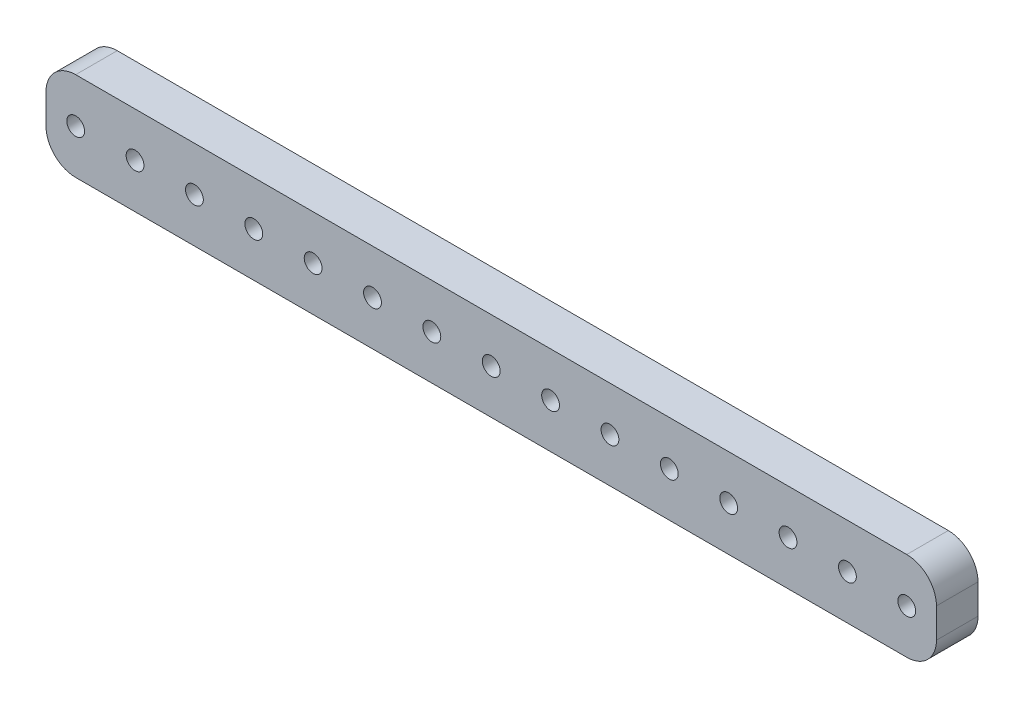
from build123d import *

# Parameters (mm, degrees)
SKETCH1_W           = 300
SKETCH1_H           = 30
BOSS_EXTRUDE1_DEPTH = 14
SKETCH2_R           = 3
CUT_EXTRUDE1_DEPTH  = 14
FILLET1_R           = 10


with BuildPart() as part:
    # Sketch1 → Boss-Extrude1 (new body)
    with BuildSketch(Plane.XY):
        Rectangle(SKETCH1_W, SKETCH1_H)
    extrude(amount=BOSS_EXTRUDE1_DEPTH)

    # Sketch2 → Cut-Extrude1 (cut)
    with BuildSketch(Plane.XY.offset(14)):
        with Locations((100, 0)):
            Circle(SKETCH2_R)
        with Locations((-100, 0)):
            Circle(SKETCH2_R)
        with Locations((-140, 0)):
            Circle(SKETCH2_R)
        with Locations((-120, 0)):
            Circle(SKETCH2_R)
        with Locations((120, 0)):
            Circle(SKETCH2_R)
        with Locations((140, 0)):
            Circle(SKETCH2_R)
        with Locations((-80, 0)):
            Circle(SKETCH2_R)
        with Locations((80, 0)):
            Circle(SKETCH2_R)
        with Locations((-60, 0)):
            Circle(SKETCH2_R)
        with Locations((-40, 0)):
            Circle(SKETCH2_R)
        with Locations((60, 0)):
            Circle(SKETCH2_R)
        with Locations((40, 0)):
            Circle(SKETCH2_R)
        with Locations((-20, 0)):
            Circle(SKETCH2_R)
        Circle(SKETCH2_R)
        with Locations((20, 0)):
            Circle(SKETCH2_R)
    extrude(amount=-CUT_EXTRUDE1_DEPTH, mode=Mode.SUBTRACT)

    # Fillet1
    fillet1_edges = [part.edges().sort_by_distance(p)[0] for p in [
        (150, -15, 7),
        (-150, -15, 7),
        (-150, 15, 7),
        (150, 15, 7),
    ]]
    fillet(fillet1_edges, radius=FILLET1_R)


solid = part.part
